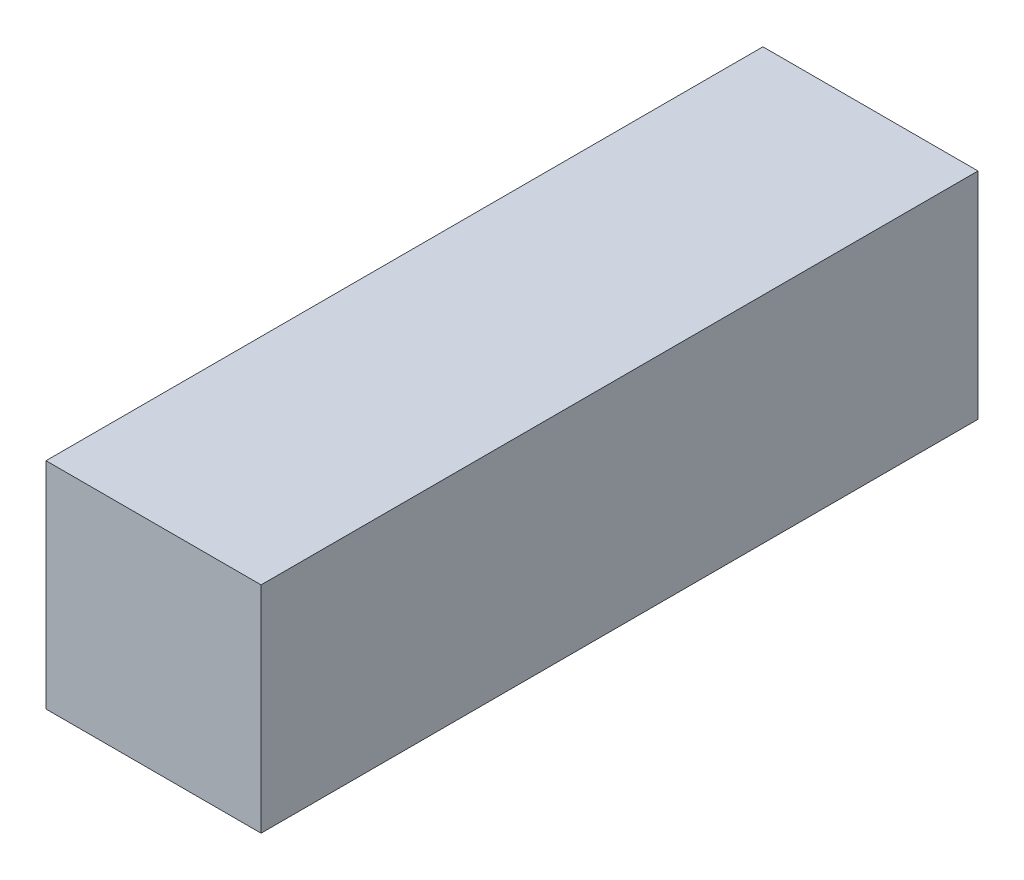
from build123d import *

# Parameters (mm, degrees)
SKETCH1_W           = 6
SKETCH1_H           = 6
BOSS_EXTRUDE1_DEPTH = 20


with BuildPart() as part:
    # Sketch1 → Boss-Extrude1 (new body)
    with BuildSketch(Plane(origin=(0, 0, 0), x_dir=(0, 1, 0), z_dir=(0, 0, 1))):
        Rectangle(SKETCH1_W, SKETCH1_H)
    extrude(amount=BOSS_EXTRUDE1_DEPTH)


solid = part.part
